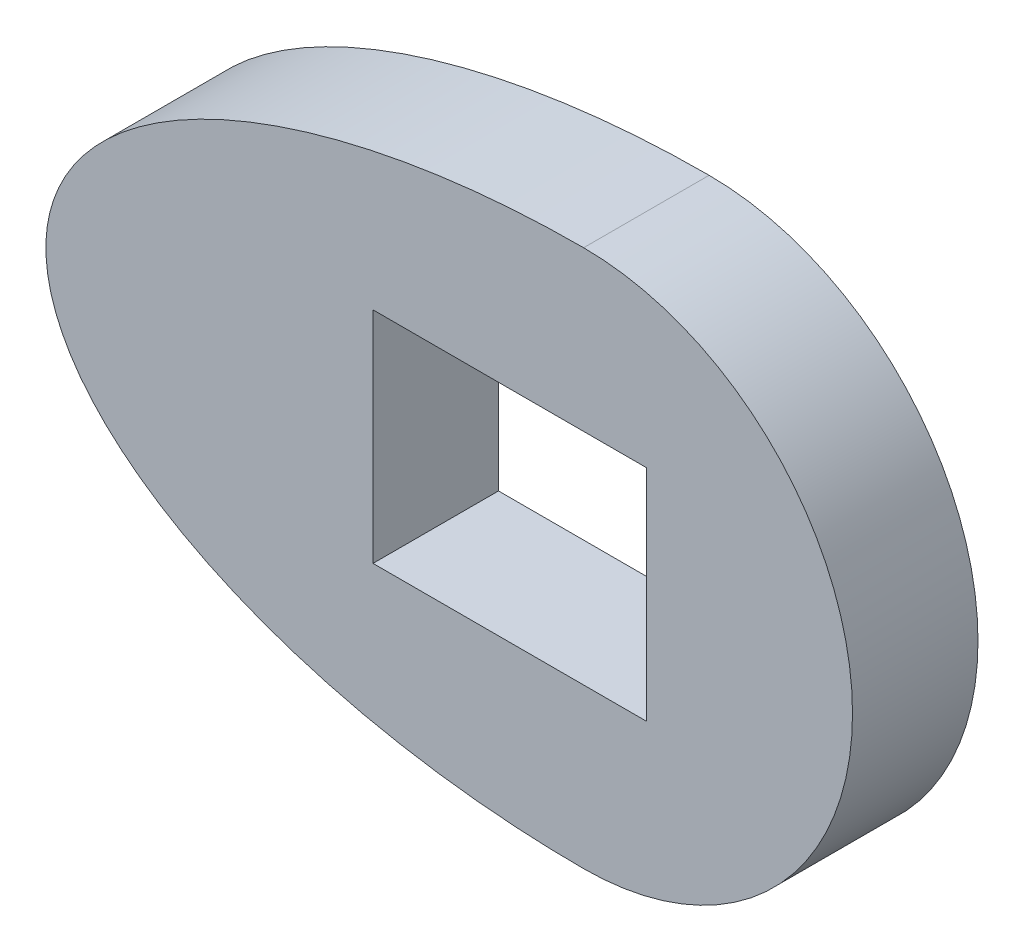
from build123d import *

# Parameters (mm, degrees)
BOSS_EXTRUDE2_DEPTH = 14
SKETCH2_W           = 30.5
SKETCH2_H           = 24.5
CUT_EXTRUDE1_DEPTH  = 14


with BuildPart() as part:
    # Sketch1 → Boss-Extrude2 (new body)
    with BuildSketch(Plane.XY):
        with BuildLine():
            ThreePointArc((0, -30), (30, 0), (0, 30))
            add(Edge.make_bspline(
                [(0, 30), (-60, 30), (-60, 0), (-60, -30), (0, -30)],
                knots=[1.570796327, 1.570796327, 1.570796327, 3.141592654, 3.141592654, 4.71238898, 4.71238898, 4.71238898], degree=2, weights=[1, 0.707106781, 1, 0.707106781, 1]))
        make_face()
    extrude(amount=BOSS_EXTRUDE2_DEPTH)

    # Sketch2 → Cut-Extrude1 (cut)
    with BuildSketch(Plane(origin=(0, 0, 0), x_dir=(-1, 0, 0), z_dir=(0, 0, -1))):
        with Locations((8.25, 0)):
            Rectangle(SKETCH2_W, SKETCH2_H)
    extrude(amount=-CUT_EXTRUDE1_DEPTH, mode=Mode.SUBTRACT)


solid = part.part
